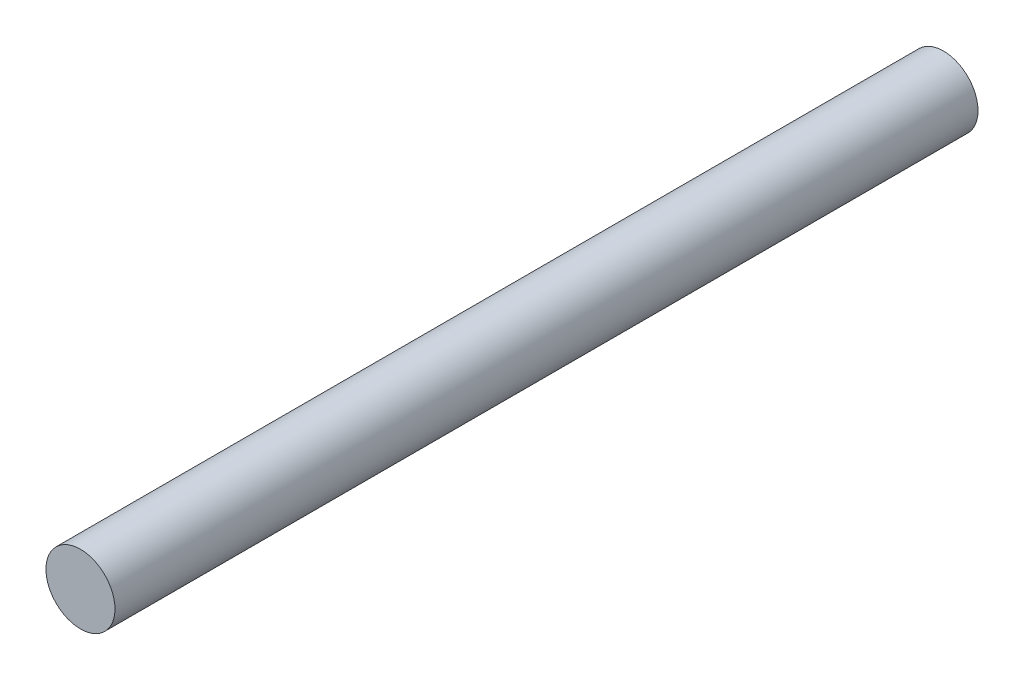
from build123d import *

# Parameters (mm, degrees)
SKETCH1_R           = 0.8
BOSS_EXTRUDE1_DEPTH = 20


with BuildPart() as part:
    # Sketch1 → Boss-Extrude1 (new body)
    with BuildSketch(Plane.XY):
        Circle(SKETCH1_R)
    extrude(amount=BOSS_EXTRUDE1_DEPTH)


solid = part.part
